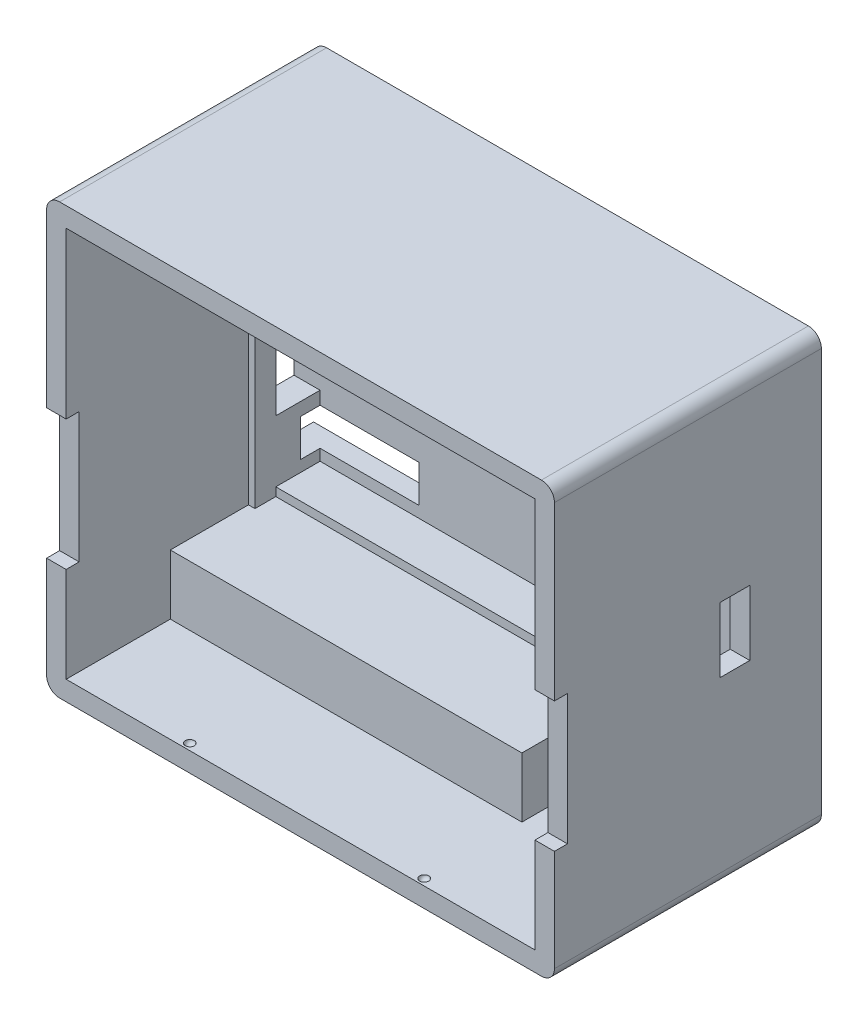
from build123d import *

# Parameters (mm, degrees)
ESQUISSE1_W                             = 33
ESQUISSE1_H                             = 39
BOSS_EXTRU_1_DEPTH                      = 1.5
ESQUISSE2_W                             = 39
ESQUISSE2_H                             = 33
ESQUISSE2_W_2                           = 36
ESQUISSE2_H_2                           = 30
BOSS_EXTRU_2_DEPTH                      = 19
ESQUISSE3_W                             = 27
ESQUISSE3_H                             = 4.6
BOSS_EXTRU_3_DEPTH                      = 11
ESQUISSE5_W                             = 26
ESQUISSE5_H                             = 0.65
BOSS_EXTRU_4_DEPTH                      = 3.4
ESQUISSE10_W                            = 0.5
ESQUISSE10_H                            = 20.8
ESQUISSE10_W_2                          = 1
ESQUISSE10_H_2                          = 3
BOSS_EXTRU_5_DEPTH                      = 5
ESQUISSE12_W                            = 10.05
ESQUISSE12_H                            = 3.4
ENL_V_MAT_EXTRU_5_DEPTH                 = 46.403744339
ESQUISSE13_W                            = 7
ESQUISSE13_H                            = 13.8
BOSS_EXTRU_6_DEPTH                      = 5.4
ESQUISSE14_W                            = 6
ESQUISSE14_H                            = 11.8
ENL_V_MAT_EXTRU_6_DEPTH                 = 2
ESQUISSE15_W                            = 5
ESQUISSE15_H                            = 2.3
ENL_V_MAT_EXTRU_7_DEPTH                 = 46.812116301
ENL_VEMENT_DE_MATI_RE_R_VOLUTION5_ANGLE = 180
SYM_TRIE4_COPY_1_ANGLE                  = 180
ESQUISSE17_W                            = 10
ESQUISSE17_H                            = 1
ENL_V_MAT_EXTRU_8_DEPTH                 = 48.047847985
CONG_1_R                                = 1
ESQUISSE18_W                            = 7.595753743
ESQUISSE18_H                            = 2.860925691
ENL_V_MAT_EXTRU_9_DEPTH                 = 32.835514759
ESQUISSE19_W                            = 2.860925691
ESQUISSE19_H                            = 3
ENL_V_MAT_EXTRU_10_DEPTH                = 46.403744339


with BuildPart() as part:
    # Esquisse1 → Boss.-Extru.1 (new body)
    with BuildSketch(Plane(origin=(0, 0, 0), x_dir=(0, 1, 0), z_dir=(0, 0, 1))):
        Rectangle(ESQUISSE1_W, ESQUISSE1_H)
    extrude(amount=BOSS_EXTRU_1_DEPTH)

    # Esquisse2 → Boss.-Extru.2 (add)
    with BuildSketch(Plane.XY.offset(1.5)):
        Rectangle(ESQUISSE2_W, ESQUISSE2_H)
        Rectangle(ESQUISSE2_W_2, ESQUISSE2_H_2, mode=Mode.SUBTRACT)
    extrude(amount=BOSS_EXTRU_2_DEPTH)

    # Esquisse3 → Boss.-Extru.3 (add)
    with BuildSketch(Plane.XY.offset(1.5)):
        with Locations((-4.5, 12.7)):
            Rectangle(ESQUISSE3_W, ESQUISSE3_H)
        with Locations((-4.5, -12.7)):
            Rectangle(ESQUISSE3_W, ESQUISSE3_H)
    extrude(amount=BOSS_EXTRU_3_DEPTH)

    # Esquisse5 → Boss.-Extru.4 (add)
    with BuildSketch(Plane.XY.offset(1.5)):
        with Locations((-5, 10.075)):
            Rectangle(ESQUISSE5_W, ESQUISSE5_H)
        with Locations((-5, -10.075)):
            Rectangle(ESQUISSE5_W, ESQUISSE5_H)
    extrude(amount=BOSS_EXTRU_4_DEPTH)

    # Esquisse10 → Boss.-Extru.5 (add)
    with BuildSketch(Plane.XY.offset(1.5)):
        with Locations((-17.75, 0)):
            Rectangle(ESQUISSE10_W, ESQUISSE10_H)
        with Locations((8.5, 8.9)):
            Rectangle(ESQUISSE10_W_2, ESQUISSE10_H_2)
        with Locations((8.5, -8.9)):
            Rectangle(ESQUISSE10_W_2, ESQUISSE10_H_2)
    extrude(amount=BOSS_EXTRU_5_DEPTH)

    # Esquisse12 → Enlèv. mat.-Extru.5 (cut, through all)
    with BuildSketch(Plane.YZ.offset(-17.5)):
        with Locations((0, 3.2)):
            Rectangle(ESQUISSE12_W, ESQUISSE12_H)
    extrude(amount=-ENL_V_MAT_EXTRU_5_DEPTH, mode=Mode.SUBTRACT)

    # Esquisse13 → Boss.-Extru.6 (add)
    with BuildSketch(Plane(origin=(-15.623853211, 9.112155963, 1.5), x_dir=(1, 0, 0), z_dir=(0, 0, 1))):
        with Locations((30.123853211, -9.112155963)):
            Rectangle(ESQUISSE13_W, ESQUISSE13_H)
    extrude(amount=BOSS_EXTRU_6_DEPTH)

    # Esquisse14 → Enlèv. mat.-Extru.6 (cut)
    with BuildSketch(Plane.XY.offset(6.9)):
        with Locations((15, 0)):
            Rectangle(ESQUISSE14_W, ESQUISSE14_H)
    extrude(amount=-ENL_V_MAT_EXTRU_6_DEPTH, mode=Mode.SUBTRACT)

    # Esquisse15 → Enlèv. mat.-Extru.7 (cut, through all)
    with BuildSketch(Plane(origin=(18, 0, 0), x_dir=(0, -1, 0), z_dir=(-1, 0, 0))):
        with Locations((0, 6.65)):
            Rectangle(ESQUISSE15_W, ESQUISSE15_H)
    extrude(amount=-ENL_V_MAT_EXTRU_7_DEPTH, mode=Mode.SUBTRACT)

    # Esquisse16 → Enlèvement de matière-Révolution5 (revolve, cut)
    with BuildSketch(Plane.XZ.offset(-14.96)):
        with BuildLine():
            Line((-8.65, 20), (-9.35, 20))
            ThreePointArc((-9.35, 20), (-9, 20.35), (-8.65, 20))
        make_face()
    enl_vement_de_mati_re_r_volution5 = revolve(axis=Axis((-14.897028004, 14.96, 20), (-1, 0, 0)), revolution_arc=ENL_VEMENT_DE_MATI_RE_R_VOLUTION5_ANGLE, mode=Mode.SUBTRACT)

    # Symétrie3: Enlèvement de matière-Révolution5 across plane
    add(enl_vement_de_mati_re_r_volution5.mirror(Plane.ZX), mode=Mode.SUBTRACT)

    # Symétrie4: Enlèvement de matière-Révolution5 across plane
    add(enl_vement_de_mati_re_r_volution5.mirror(Plane(origin=(0, 0, 0), x_dir=(0, 0, 1), z_dir=(1, 0, 0))), mode=Mode.SUBTRACT)

    # Symétrie4 copy 1 sketch → Symétrie4 copy 1 (revolve, cut)
    with BuildSketch(Plane(origin=(0, -14.96, 0), x_dir=(-1, 0, 0), z_dir=(0, 1, 0))):
        with BuildLine():
            Line((-8.65, 20), (-9.35, 20))
            ThreePointArc((-9.35, 20), (-9, 20.35), (-8.65, 20))
        make_face()
    revolve(axis=Axis((14.897028004, -14.96, 20), (1, 0, 0)), revolution_arc=SYM_TRIE4_COPY_1_ANGLE, mode=Mode.SUBTRACT)

    # Esquisse17 → Enlèv. mat.-Extru.8 (cut, through all)
    with BuildSketch(Plane(origin=(-19.5, 0, 0), x_dir=(0, -1, 0), z_dir=(-1, 0, 0))):
        with Locations((2.694173084, 20)):
            Rectangle(ESQUISSE17_W, ESQUISSE17_H)
    extrude(amount=-ENL_V_MAT_EXTRU_8_DEPTH, mode=Mode.SUBTRACT)

    # Congé1
    cong_1_edges = [part.edges().sort_by_distance(p)[0] for p in [
        (-19.5, -16.5, 10.25),
        (-19.5, 16.5, 10.25),
        (19.5, 16.5, 10.25),
        (19.5, -16.5, 10.25),
    ]]
    fillet(cong_1_edges, radius=CONG_1_R)

    # Esquisse18 → Enlèv. mat.-Extru.9 (cut, through all)
    with BuildSketch(Plane.XY.offset(1.5)):
        with Locations((-13.702123129, 7.455462846)):
            Rectangle(ESQUISSE18_W, ESQUISSE18_H)
        with Locations((-13.702123129, -7.455462846)):
            Rectangle(ESQUISSE18_W, ESQUISSE18_H)
    extrude(amount=-ENL_V_MAT_EXTRU_9_DEPTH, mode=Mode.SUBTRACT)

    # Esquisse19 → Enlèv. mat.-Extru.10 (cut, through all)
    with BuildSketch(Plane.YZ.offset(-17.5)):
        with Locations((-7.455462846, 1.5)):
            Rectangle(ESQUISSE19_W, ESQUISSE19_H)
        with Locations((7.455462846, 1.5)):
            Rectangle(ESQUISSE19_W, ESQUISSE19_H)
    extrude(amount=-ENL_V_MAT_EXTRU_10_DEPTH, mode=Mode.SUBTRACT)


solid = part.part
